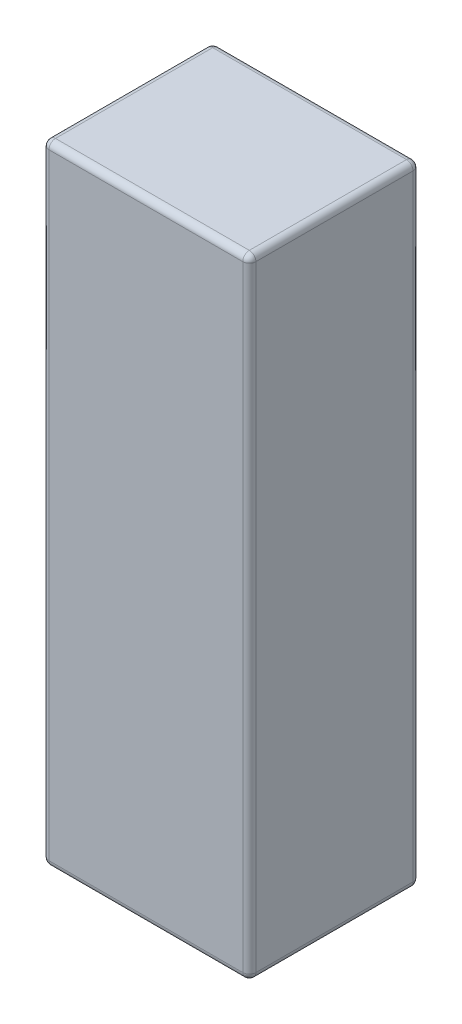
from build123d import *

# Parameters (mm, degrees)
SKIZZE1_W                       = 15.8
SKIZZE1_H                       = 13
AUFSATZ_LINEAR_AUSTRAGEN1_DEPTH = 48
VERRUNDUNG1_R                   = 0.5


with BuildPart() as part:
    # Skizze1 → Aufsatz-Linear austragen1 (new body)
    with BuildSketch(Plane(origin=(0, 0, 0), x_dir=(1, 0, 0), z_dir=(0, 1, 0))):
        Rectangle(SKIZZE1_W, SKIZZE1_H)
    extrude(amount=AUFSATZ_LINEAR_AUSTRAGEN1_DEPTH)

    # Verrundung1
    verrundung1_edges = [part.edges().sort_by_distance(p)[0] for p in [
        (-7.9, 48, 0),
        (0, 48, 6.5),
        (7.9, 48, 0),
        (0, 0, 6.5),
        (-7.9, 0, 0),
        (0, 0, -6.5),
        (7.9, 0, 0),
        (0, 48, -6.5),
        (7.9, 24, 6.5),
        (-7.9, 24, 6.5),
        (-7.9, 24, -6.5),
        (7.9, 24, -6.5),
    ]]
    fillet(verrundung1_edges, radius=VERRUNDUNG1_R)


solid = part.part
